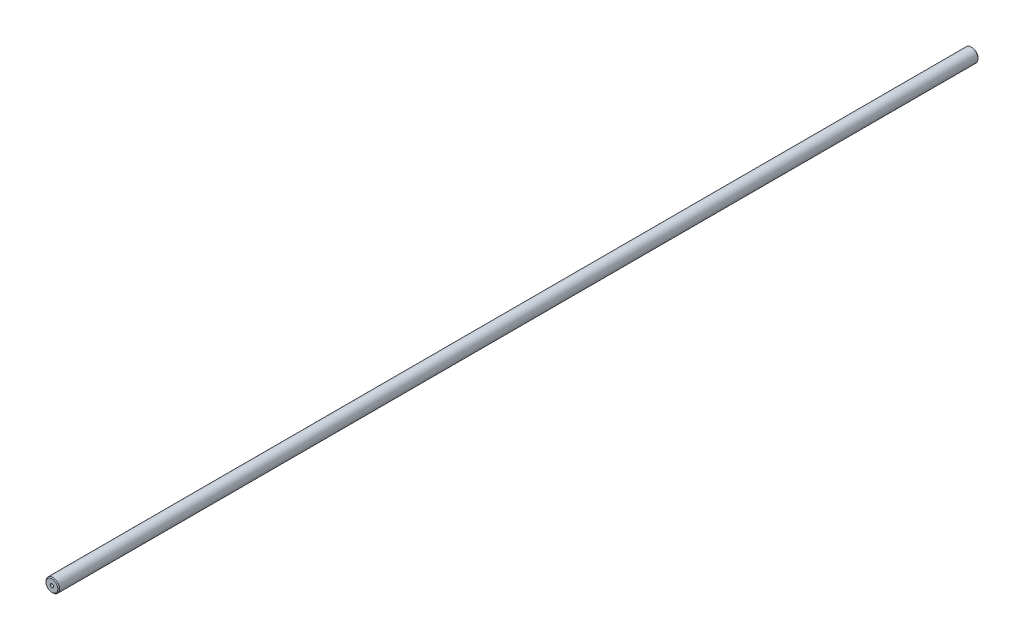
from build123d import *

# Parameters (mm, degrees)
SKETCH1_R           = 4
BOSS_EXTRUDE1_DEPTH = 544
SKETCH2_R           = 1
CUT_EXTRUDE1_DEPTH  = 10
CHAMFER1_SIZE       = 0.5


with BuildPart() as part:
    # Sketch1 → Boss-Extrude1 (new body)
    with BuildSketch(Plane.XY):
        Circle(SKETCH1_R)
    extrude(amount=BOSS_EXTRUDE1_DEPTH)

    # Sketch2 → Cut-Extrude1 (cut)
    with BuildSketch(Plane.XY.offset(544)):
        Circle(SKETCH2_R)
    extrude(amount=-CUT_EXTRUDE1_DEPTH, mode=Mode.SUBTRACT)

    # Chamfer1
    chamfer1_edges = [part.edges().sort_by_distance(p)[0] for p in [
        (-4, 0, 0),
        (-4, 0, 544),
    ]]
    chamfer(chamfer1_edges, length=CHAMFER1_SIZE)


solid = part.part
